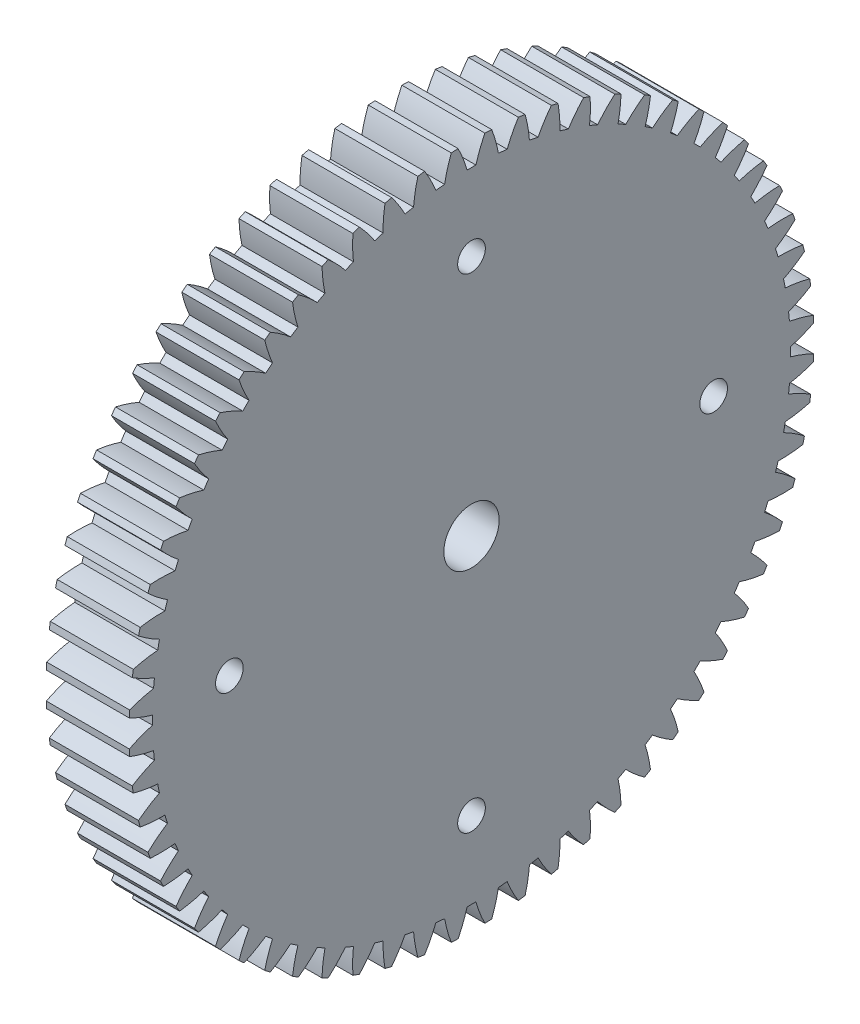
from build123d import *

# Parameters (mm, degrees)
BASPROSKE_W        = 12
BASPROSKE_H        = 49.5
TOOTHCUT_DEPTH     = 72.024643611
TEETHCUTS_COUNT    = 64
TEETHCUTS_ANGLE    = 354.375
BORSKE_R           = 4
BORE_DEPTH         = 50.0000508
SKETCH3_R          = 2
CUT_EXTRUDE1_DEPTH = 71.9718959


with BuildPart() as part:
    # BasProSke → Base-Revolve (revolve)
    with BuildSketch(Plane(origin=(0, 0, 0), x_dir=(1, 0, 0), z_dir=(0, 1, 0)), mode=Mode.PRIVATE) as base_revolve_sk:
        with Locations((6, 24.75)):
            Rectangle(BASPROSKE_W, BASPROSKE_H)
    revolve(base_revolve_sk.sketch.rotate(Axis((-10, 0, 0), (1, 0, 0)), 180), axis=Axis((-10, 0, 0), (1, 0, 0)))

    # TooCutSke → ToothCut (cut, through all)
    with BuildSketch(Plane(origin=(0, 0, 0), x_dir=(0, 0, -1), z_dir=(1, 0, 0))):
        with BuildLine():
            ThreePointArc((0.635076871, 46.119627637), (0, 46.124), (-0.635076871, 46.119627637))
            ThreePointArc((-0.635076871, 46.119627637), (-1.211981228, 47.834312084), (-1.947712443, 49.487085804))
            ThreePointArc((-1.947712443, 49.487085804), (0, 49.5254), (1.947712443, 49.487085804))
            ThreePointArc((1.947712443, 49.487085804), (1.211981228, 47.834312084), (0.635076871, 46.119627637))
        make_face()
    toothcut = extrude(amount=TOOTHCUT_DEPTH, mode=Mode.SUBTRACT)

    # TeethCuts: ToothCut ×64 about axis
    teethcuts_axis = Axis((-10, 0, 0), (1, 0, 0))
    for i in range(1, TEETHCUTS_COUNT):
        add(toothcut.rotate(teethcuts_axis, i * TEETHCUTS_ANGLE / (TEETHCUTS_COUNT - 1)), mode=Mode.SUBTRACT)

    # BorSke → Bore (cut, symmetric)
    with BuildSketch(Plane(origin=(0, 0, 0), x_dir=(0, 0, -1), z_dir=(1, 0, 0))):
        with Locations(Location((0, 0, 0), (0, 0, 180))):
            Circle(BORSKE_R)
    extrude(amount=BORE_DEPTH, both=True, mode=Mode.SUBTRACT)

    # Sketch3 → Cut-Extrude1 (cut, through all)
    with BuildSketch(Plane(origin=(12, 0, 0), x_dir=(0, 0, -1), z_dir=(1, 0, 0))):
        with Locations((0, 35)):
            Circle(SKETCH3_R)
        with Locations((35, 0)):
            Circle(SKETCH3_R)
        with Locations((0, -35)):
            Circle(SKETCH3_R)
        with Locations((-35, 0)):
            Circle(SKETCH3_R)
    extrude(amount=-CUT_EXTRUDE1_DEPTH, mode=Mode.SUBTRACT)


solid = part.part
